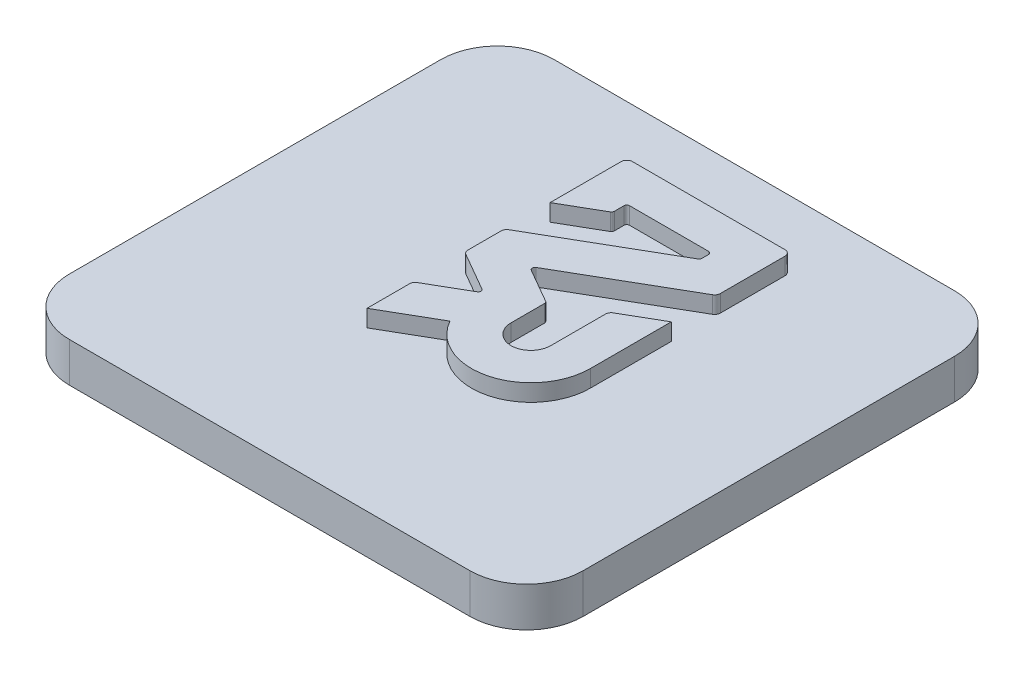
from build123d import *

# Parameters (mm, degrees)
SKETCH1_W           = 90.757028804
SKETCH1_H           = 85.620479834
BOSS_EXTRUDE1_DEPTH = 10
SKETCH2_W           = 90.757028804
SKETCH2_H           = 85.620479834
CUT_EXTRUDE1_DEPTH  = 3
FILLET3_R           = 10
FILLET4_R           = 0.5


with BuildPart() as part:
    # Sketch1 → Boss-Extrude1 (new body)
    with BuildSketch(Plane(origin=(0, 0, 0), x_dir=(1, 0, 0), z_dir=(0, 1, 0))):
        with Locations((50.879550114, -25.035867198)):
            Rectangle(SKETCH1_W, SKETCH1_H)
    extrude(amount=BOSS_EXTRUDE1_DEPTH)

    # Sketch2 → Cut-Extrude1 (cut)
    with BuildSketch(Plane(origin=(0, 10, 0), x_dir=(1, 0, 0), z_dir=(0, 1, 0))):
        with Locations((50.879550114, -25.035867198)):
            Rectangle(SKETCH2_W, SKETCH2_H)
        with BuildLine():
            ThreePointArc((67.972256686, 6.083430281), (68.679363467, 5.790537062), (68.972256686, 5.083430281))
            Line((68.972256686, 5.083430281), (68.972256686, -6.33921945))
            ThreePointArc((68.972256686, -6.33921945), (68.83828209, -6.83921945), (68.472256686, -7.205244854))
            Line((68.472256686, -7.205244854), (48.722256686, -18.60791267))
            ThreePointArc((48.722256686, -18.60791267), (48.472256686, -19.040925372), (48.722256686, -19.473938074))
            Line((48.722256686, -19.473938074), (54.972256686, -23.082377257))
            Line((54.972256686, -23.082377257), (54.972256686, -29.289636678))
            ThreePointArc((54.972256686, -29.289636678), (58.472256686, -32.789636678), (61.972256686, -29.289636678))
            Line((61.972256686, -29.289636678), (61.972256686, -19.618275642))
            ThreePointArc((61.972256686, -19.618275642), (62.106231282, -19.118275642), (62.472256686, -18.752250238))
            Line((62.472256686, -18.752250238), (68.972256686, -14.999473488))
            Line((68.972256686, -14.999473488), (68.972256686, -29.289636678))
            ThreePointArc((68.972256686, -29.289636678), (61.12912537, -39.447936181), (49.316818821, -34.430449599))
            Line((49.316818821, -34.430449599), (47.972256686, -35.20673291))
            Line((47.972256686, -35.20673291), (40.034434513, -39.789636678))
            Line((40.034434513, -39.789636678), (40.034434513, -32.284083179))
            ThreePointArc((40.034434513, -32.284083179), (40.168409109, -31.784083179), (40.534434513, -31.418057775))
            Line((40.534434513, -31.418057775), (47.972256686, -27.123829141))
            Line((47.972256686, -27.123829141), (40.534434513, -22.829600507))
            ThreePointArc((40.534434513, -22.829600507), (40.168409109, -22.463575103), (40.034434513, -21.963575103))
            Line((40.034434513, -21.963575103), (40.034434513, -16.118275642))
            ThreePointArc((40.034434513, -16.118275642), (40.168409109, -15.618275642), (40.534434513, -15.252250238))
            Line((40.534434513, -15.252250238), (61.722256686, -3.019455402))
            ThreePointArc((61.722256686, -3.019455402), (61.905269388, -2.8364427), (61.972256686, -2.5864427))
            Line((61.972256686, -2.5864427), (61.972256686, -1.416569719))
            ThreePointArc((61.972256686, -1.416569719), (61.825810077, -1.063016329), (61.472256686, -0.916569719))
            Line((61.472256686, -0.916569719), (47.534434513, -0.916569719))
            ThreePointArc((47.534434513, -0.916569719), (47.180881122, -1.063016329), (47.034434513, -1.416569719))
            Line((47.034434513, -1.416569719), (47.034434513, -3.127894585))
            ThreePointArc((47.034434513, -3.127894585), (46.967447214, -3.377894585), (46.784434513, -3.560907287))
            Line((46.784434513, -3.560907287), (40.034434513, -7.458021604))
            Line((40.034434513, -7.458021604), (40.034434513, -6.916569719))
            Line((40.034434513, -6.916569719), (40.034434513, 5.083430281))
            ThreePointArc((40.034434513, 5.083430281), (40.327327731, 5.790537062), (41.034434513, 6.083430281))
            Line((41.034434513, 6.083430281), (67.972256686, 6.083430281))
        make_face(mode=Mode.SUBTRACT)
    extrude(amount=-CUT_EXTRUDE1_DEPTH, mode=Mode.SUBTRACT)

    # Fillet3
    fillet3_edges = [part.edges().sort_by_distance(p)[0] for p in [
        (5.501035712, 3.5, -17.774372719),
        (96.258064516, 3.5, -17.774372719),
        (96.258064516, 3.5, 67.846107115),
        (5.501035712, 3.5, 67.846107115),
    ]]
    fillet(fillet3_edges, radius=FILLET3_R)

    # Fillet4
    fillet4_edges = [part.edges().sort_by_distance(p)[0] for p in [
        (47.972256686, 8.5, 27.123829141),
        (54.972256686, 8.5, 23.082377257),
    ]]
    fillet(fillet4_edges, radius=FILLET4_R)


solid = part.part
